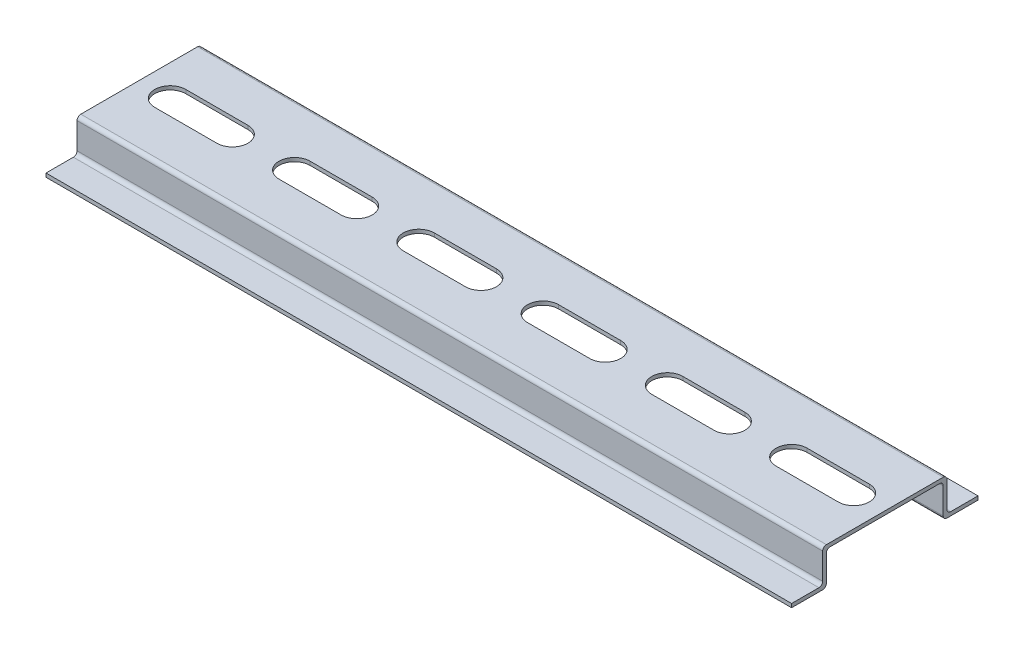
from build123d import *

# Parameters (mm, degrees)
BOSS_EXTRUDE1_DEPTH = 240
CUT_EXTRUDE1_DEPTH  = 243.165232847


with BuildPart() as part:
    # Sketch1 → Boss-Extrude1 (new body)
    with BuildSketch(Plane(origin=(0, 0, 0), x_dir=(0, 0, -1), z_dir=(1, 0, 0))):
        with BuildLine():
            Line((-21.2, 0), (-30, 0))
            Line((-30, 0), (-30, -1.2))
            Line((-30, -1.2), (-20, -1.2))
            ThreePointArc((-20, -1.2), (-19.151471863, -0.848528137), (-18.8, 0))
            Line((-18.8, 0), (-18.8, 8.4))
            ThreePointArc((-18.8, 8.4), (-18.448528137, 9.248528137), (-17.6, 9.6))
            Line((-17.6, 9.6), (17.6, 9.6))
            ThreePointArc((17.6, 9.6), (18.448528137, 9.248528137), (18.8, 8.4))
            Line((18.8, 8.4), (18.8, 0))
            ThreePointArc((18.8, 0), (19.151471863, -0.848528137), (20, -1.2))
            Line((20, -1.2), (30, -1.2))
            Line((30, -1.2), (30, 0))
            Line((30, 0), (21.2, 0))
            ThreePointArc((21.2, 0), (20.351471863, 0.351471863), (20, 1.2))
            Line((20, 1.2), (20, 9.6))
            ThreePointArc((20, 9.6), (19.648528137, 10.448528137), (18.8, 10.8))
            Line((18.8, 10.8), (-18.8, 10.8))
            ThreePointArc((-18.8, 10.8), (-19.648528137, 10.448528137), (-20, 9.6))
            Line((-20, 9.6), (-20, 1.2))
            ThreePointArc((-20, 1.2), (-20.351471863, 0.351471863), (-21.2, 0))
        make_face()
    extrude(amount=-BOSS_EXTRUDE1_DEPTH)

    # Sketch2 → Cut-Extrude1 (cut, through all)
    with BuildSketch(Plane(origin=(0, 10.8, 0), x_dir=(1, 0, 0), z_dir=(0, 1, 0))):
        with BuildLine():
            Line((-230, 5), (-210, 5))
            ThreePointArc((-210, 5), (-205, 0), (-210, -5))
            Line((-210, -5), (-230, -5))
            ThreePointArc((-230, -5), (-235, 0), (-230, 5))
        make_face()
        with BuildLine():
            Line((-190, 5), (-170, 5))
            ThreePointArc((-170, 5), (-165, 0), (-170, -5))
            Line((-170, -5), (-190, -5))
            ThreePointArc((-190, -5), (-195, 0), (-190, 5))
        make_face()
        with BuildLine():
            Line((-150, 5), (-130, 5))
            ThreePointArc((-130, 5), (-125, 0), (-130, -5))
            Line((-130, -5), (-150, -5))
            ThreePointArc((-150, -5), (-155, 0), (-150, 5))
        make_face()
        with BuildLine():
            Line((-110, 5), (-90, 5))
            ThreePointArc((-90, 5), (-85, 0), (-90, -5))
            Line((-90, -5), (-110, -5))
            ThreePointArc((-110, -5), (-115, 0), (-110, 5))
        make_face()
        with BuildLine():
            Line((-70, 5), (-50, 5))
            ThreePointArc((-50, 5), (-45, 0), (-50, -5))
            Line((-50, -5), (-70, -5))
            ThreePointArc((-70, -5), (-75, 0), (-70, 5))
        make_face()
        with BuildLine():
            Line((-30, 5), (-10, 5))
            ThreePointArc((-10, 5), (-5, 0), (-10, -5))
            Line((-10, -5), (-30, -5))
            ThreePointArc((-30, -5), (-35, 0), (-30, 5))
        make_face()
    extrude(amount=-CUT_EXTRUDE1_DEPTH, mode=Mode.SUBTRACT)


solid = part.part
